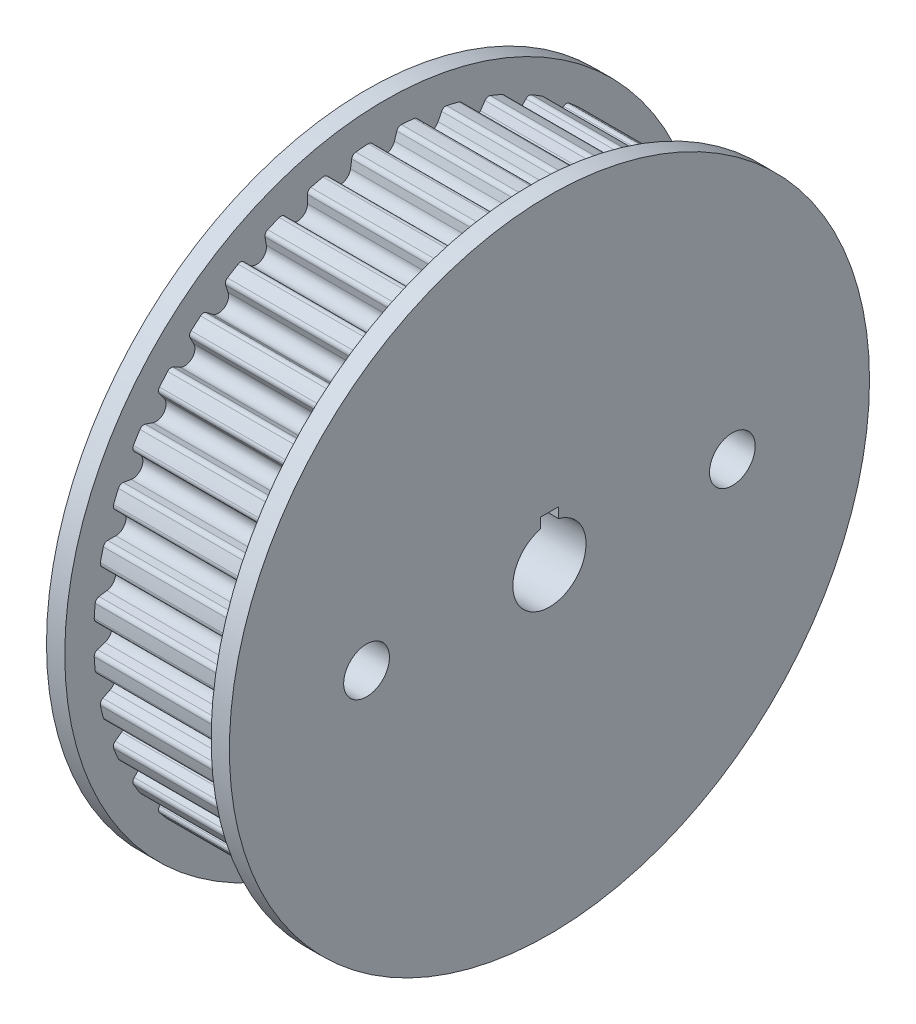
from build123d import *

# Parameters (mm, degrees)
SKETCH_1_W               = 16
SKETCH_1_H               = 27.83
SKETCH_4_W               = 2
SKETCH_4_H               = 1.127016654
CUT_EXTRUDE_1_DEPTH      = 48.773400549
CUT_EXTRUDE_2_REACH      = 49.773
PATTERN_CIRCULAR_3_COUNT = 40
EXTRUDE_START            = 2
SKETCH_7_R               = 35
EXTRUDE_1_DEPTH          = 2
SKETCH_9_R               = 35
EXTRUDE_2_DEPTH          = 2
SKETCH_10_R              = 2.5
CUT_EXTRUDE_3_DEPTH      = 54.38539126


with BuildPart() as part:
    # 草图1 → 旋转1 (revolve)
    with BuildSketch(Plane.XY):
        with Locations((8, 17.915)):
            Rectangle(SKETCH_1_W, SKETCH_1_H)
    revolve(axis=Axis((0, 0, 0), (1, 0, 0)))

    # 草图4 → 切除-拉伸1 (cut, through all)
    with BuildSketch(Plane.ZY):
        with Locations((0, 4.436491673)):
            Rectangle(SKETCH_4_W, SKETCH_4_H)
    extrude(amount=-CUT_EXTRUDE_1_DEPTH, mode=Mode.SUBTRACT)

    # 草图6 → 切除-拉伸2 (cut, up to next)
    with BuildSketch(Plane(origin=(0, 0, 0), x_dir=(0, 0, -1), z_dir=(1, 0, 0)), mode=Mode.PRIVATE) as cut_extrude_2_sk1:
        with BuildLine():
            Line((1.310813729, 31.429309533), (1.049088646, 30.599223621))
            ThreePointArc((1.049088646, 30.599223621), (0, 29.83), (-1.049088646, 30.599223621))
            Line((-1.049088646, 30.599223621), (-1.310813729, 31.429309533))
            ThreePointArc((-1.310813729, 31.429309533), (-1.503646333, 31.690453055), (-1.816201923, 31.778142025))
            ThreePointArc((-1.816201923, 31.778142025), (-2.065738599, 31.762896972), (-2.315147839, 31.745692471))
            Line((-2.315147839, 31.745692471), (-2.800365769, 33.284607137))
            ThreePointArc((-2.800365769, 33.284607137), (0, 33.402202334), (2.800365769, 33.284607137))
            Line((2.800365769, 33.284607137), (2.315147839, 31.745692471))
            ThreePointArc((2.315147839, 31.745692471), (2.065738599, 31.762896972), (1.816201923, 31.778142025))
            ThreePointArc((1.816201923, 31.778142025), (1.503646333, 31.690453055), (1.310813729, 31.429309533))
        make_face()
    cut_extrude_2_tool1 = extrude(cut_extrude_2_sk1.sketch, amount=CUT_EXTRUDE_2_REACH, mode=Mode.PRIVATE) & part.part
    cut_extrude_2 = cut_extrude_2_tool1.solids().sort_by_distance((0, 32.043521, 0))[0]
    add(cut_extrude_2, mode=Mode.SUBTRACT)

    # 阵列(圆周)3: 切除-拉伸2 ×40 about axis
    pattern_circular_3_axis = Axis((-1.4, 0, 0), (1, 0, 0))
    for i in range(1, PATTERN_CIRCULAR_3_COUNT):
        add(cut_extrude_2.rotate(pattern_circular_3_axis, i * 360 / PATTERN_CIRCULAR_3_COUNT), mode=Mode.SUBTRACT)

    # 草图7 → 凸台-拉伸1 (add)
    with BuildSketch(Plane.ZY.offset(EXTRUDE_START)):
        Circle(SKETCH_7_R)
        with BuildLine():
            Line((-1, 5), (-1, 3.872983346))
            ThreePointArc((-1, 3.872983346), (0, -4), (1, 3.872983346))
            Line((1, 3.872983346), (1, 5))
            Line((1, 5), (-1, 5))
        make_face(mode=Mode.SUBTRACT)
    extrude(amount=-EXTRUDE_1_DEPTH)

    # 草图9 → 凸台-拉伸2 (add)
    with BuildSketch(Plane(origin=(16, 0, 0), x_dir=(0, 0, -1), z_dir=(1, 0, 0))):
        Circle(SKETCH_9_R)
        with BuildLine():
            Line((1, 5), (1, 3.872983346))
            ThreePointArc((1, 3.872983346), (0, -4), (-1, 3.872983346))
            Line((-1, 3.872983346), (-1, 5))
            Line((-1, 5), (1, 5))
        make_face(mode=Mode.SUBTRACT)
    extrude(amount=EXTRUDE_2_DEPTH)

    # 草图10 → 切除-拉伸3 (cut, through all)
    with BuildSketch(Plane(origin=(18, 0, 0), x_dir=(0, 0, -1), z_dir=(1, 0, 0))):
        with Locations((-20, 0)):
            Circle(SKETCH_10_R)
        with Locations((20, 0)):
            Circle(SKETCH_10_R)
    extrude(amount=-CUT_EXTRUDE_3_DEPTH, mode=Mode.SUBTRACT)


solid = part.part
